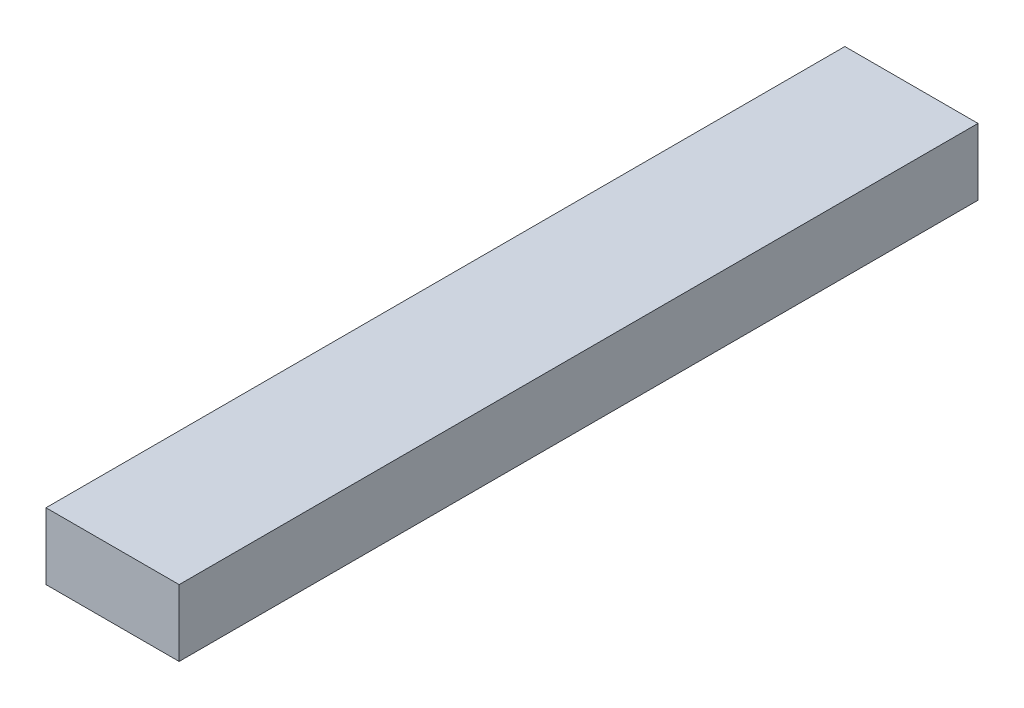
from build123d import *

# Parameters (mm, degrees)
SKETCH1_W           = 304.8
SKETCH1_H           = 304.8
BOSS_EXTRUDE1_DEPTH = 6.35
CUT_EXTRUDE2_DEPTH  = 6.35


with BuildPart() as part:
    # Sketch1 → Boss-Extrude1 (new body)
    with BuildSketch(Plane(origin=(0, 0, 0), x_dir=(1, 0, 0), z_dir=(0, 1, 0))):
        with Locations((152.4, 152.4)):
            Rectangle(SKETCH1_W, SKETCH1_H)
    extrude(amount=BOSS_EXTRUDE1_DEPTH)

    # Sketch2 → Cut-Extrude2 (cut)
    with BuildSketch(Plane(origin=(0, 6.35, 0), x_dir=(1, 0, 0), z_dir=(0, 1, 0))):
        Polygon((12.7, 304.8), (12.7, 228.6), (0, 228.6), (0, 0), (304.8, 0), (304.8, 304.8), align=None)
    extrude(amount=-CUT_EXTRUDE2_DEPTH, mode=Mode.SUBTRACT)


solid = part.part
